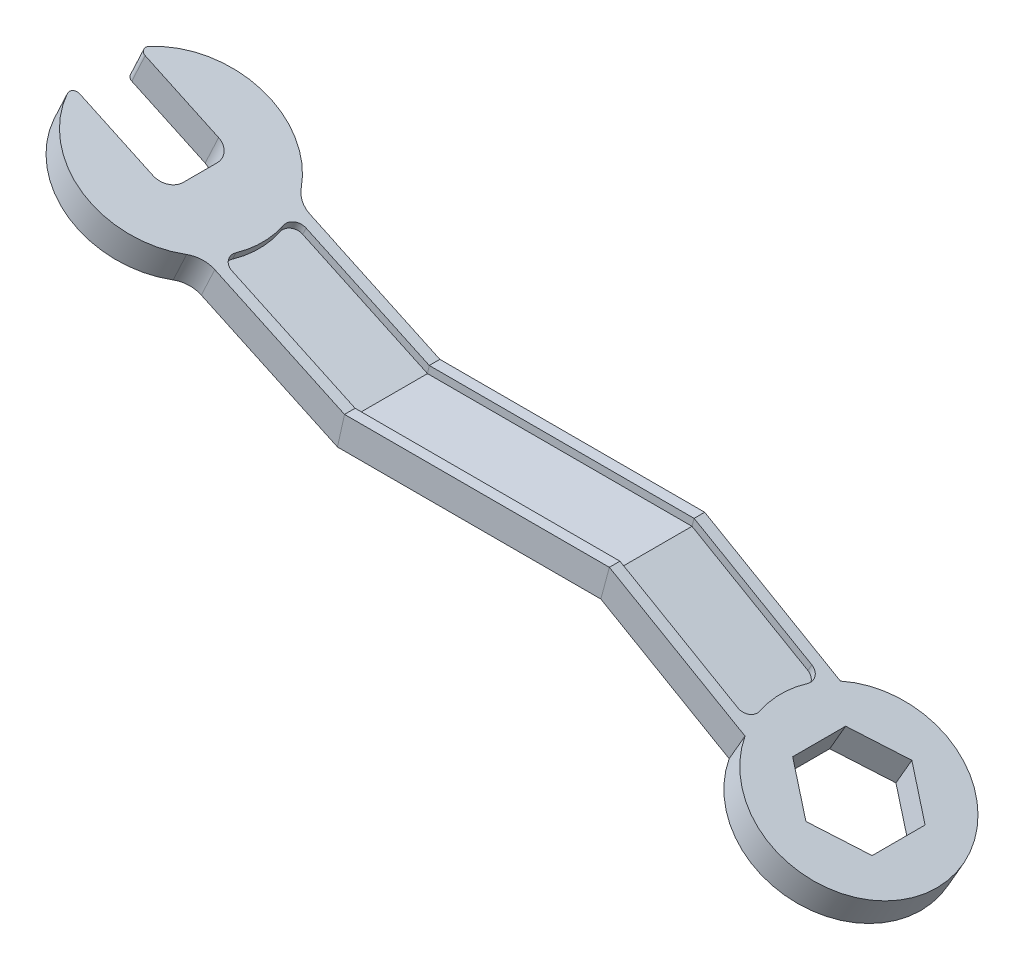
from build123d import *

# Parameters (mm, degrees)
EXTRUDE_START       = 1.5
EXTRUDE_1_DEPTH     = 6
FILLET_1_R          = 1
FILLET_2_R          = 5
FILLET_3_R          = 3
CUT_EXTRUDE_1_DEPTH = 1.5
FILLET_4_R          = 2
CUT_EXTRUDE_START   = -4.5
CUT_EXTRUDE_2_DEPTH = 1.5
FILLET_5_R          = 2
EXTRUDE_2_DEPTH     = 6
CUT_EXTRUDE_3_DEPTH = 1.5
FILLET_6_R          = 2
CUT_EXTRUDE_4_DEPTH = 1.5
FILLET_7_R          = 2


with BuildPart() as part:
    # 扫描2: sweep along a path in 草图1
    with BuildLine(Plane.XY) as sweep_2_path:
        Line((-19.938771315, 9.297601758), (0, 0))
        Line((0, 0), (50, 0))
        Line((50, 0), (69.052558883, -11))
    # 草图2 → 扫描2 (sweep)
    with BuildSketch(Plane(origin=(0, 0, 0), x_dir=(0, 0, -1), z_dir=(1, 0, 0))):
        Polygon((0, 0), (2, 0), (2, -1.5), (16, -1.5), (16, 0), (18, 0), (18, -6), (16, -6), (16, -4.5), (2, -4.5), (2, -6), (0, -6), align=None)
    sweep(path=sweep_2_path.line, transition=Transition.RIGHT)

    # 草图3 → 凸台-拉伸1 (add)
    with BuildSketch(Plane(origin=(-0.633927393, -1.359461681, 0), x_dir=(0.9063077870366528, -0.42261826174069356, 0), z_dir=(0.42261826174069356, 0.9063077870366528, 0)).offset(EXTRUDE_START)):
        with BuildLine():
            Line((-22, 9), (-22, 18.019216451))
            Line((-22, 18.019216451), (-29.589804491, 18.019216451))
            ThreePointArc((-29.589804491, 18.019216451), (-45.578071203, 25.926597156), (-59.82908715, 15.2))
            Line((-59.82908715, 15.2), (-40, 15.2))
            Line((-40, 15.2), (-40, 9))
            Line((-40, 9), (-40, 2.8))
            Line((-40, 2.8), (-59.82908715, 2.8))
            ThreePointArc((-59.82908715, 2.8), (-45.56678948, -7.927645162), (-29.577794898, 0))
            Line((-29.577794898, 0), (-22, 0))
            Line((-22, 0), (-22, 9))
        make_face()
    extrude(amount=-EXTRUDE_1_DEPTH)

    # 圆角1
    fillet_1_edges = [part.edges().sort_by_distance(p)[0] for p in [
        (-55.49142236, 22.565941452, -2.8),
        (-55.49142236, 22.565941452, -15.2),
    ]]
    fillet(fillet_1_edges, radius=FILLET_1_R)

    # 圆角2
    fillet_2_edges = [part.edges().sort_by_distance(p)[0] for p in [
        (-28.074440625, 9.781192905, 0),
        (-28.085325012, 9.786268378, -18.019216451),
    ]]
    fillet(fillet_2_edges, radius=FILLET_2_R)

    # 圆角3
    fillet_3_edges = [part.edges().sort_by_distance(p)[0] for p in [
        (-37.520166267, 14.185807109, -2.8),
        (-37.520166267, 14.185807109, -15.2),
    ]]
    fillet(fillet_3_edges, radius=FILLET_3_R)

    # 草图4 → 切除-拉伸1 (cut)
    with BuildSketch(Plane(origin=(0, 0, 0), x_dir=(0.9063077870366528, -0.42261826174069356, 0), z_dir=(0.42261826174069356, 0.9063077870366528, 0))):
        with BuildLine():
            Line((-22, 16), (-28.508066615, 16))
            ThreePointArc((-28.508066615, 16), (-27, 9), (-28.508066615, 2))
            Line((-28.508066615, 2), (-22, 2))
            Line((-22, 2), (-22, 16))
        make_face()
    extrude(amount=-CUT_EXTRUDE_1_DEPTH, mode=Mode.SUBTRACT)

    # 圆角4
    fillet_4_edges = [part.edges().sort_by_distance(p)[0] for p in [
        (-26.154046463, 11.368298718, -2),
        (-26.154046463, 11.368298718, -16),
    ]]
    fillet(fillet_4_edges, radius=FILLET_4_R)

    # 草图4<2> → 切除-拉伸2 (cut)
    with BuildSketch(Plane(origin=(0, 0, 0), x_dir=(0.9063077870366528, -0.42261826174069356, 0), z_dir=(0.42261826174069356, 0.9063077870366528, 0)).offset(CUT_EXTRUDE_START)):
        with BuildLine():
            Line((-22, 16), (-28.508066615, 16))
            ThreePointArc((-28.508066615, 16), (-27, 9), (-28.508066615, 2))
            Line((-28.508066615, 2), (-22, 2))
            Line((-22, 2), (-22, 16))
        make_face()
    extrude(amount=-CUT_EXTRUDE_2_DEPTH, mode=Mode.SUBTRACT)

    # 圆角5
    fillet_5_edges = [part.edges().sort_by_distance(p)[0] for p in [
        (-28.055828641, 7.289913677, -16),
        (-28.055828641, 7.289913677, -2),
    ]]
    fillet(fillet_5_edges, radius=FILLET_5_R)

    # 草图7 → 凸台-拉伸2 (add)
    with BuildSketch(Plane(origin=(12.5, 21.650635095, 0), x_dir=(0.866025403784438, -0.5000000000000012, 0), z_dir=(0.5000000000000011, 0.8660254037844379, 0))):
        with BuildLine():
            Line((72.879065087, 18), (65.301270189, 18))
            Line((65.301270189, 18), (65.301270189, 16))
            Line((65.301270189, 16), (65.301270189, 0))
            Line((65.301270189, 0), (72.879065087, 0))
            ThreePointArc((72.879065087, 0), (104.301270189, 9), (72.879065087, 18))
        make_face()
        Polygon((78.641016151, 14), (87.301270189, 19), (95.961524227, 14), (95.961524227, 4), (87.301270189, -1), (78.641016151, 4), align=None, mode=Mode.SUBTRACT)
    extrude(amount=-EXTRUDE_2_DEPTH)

    # 草图8 → 切除-拉伸3 (cut)
    with BuildSketch(Plane(origin=(12.5, 21.650635095, 0), x_dir=(0.866025403784438, -0.5000000000000012, 0), z_dir=(0.5000000000000011, 0.8660254037844379, 0))):
        with BuildLine():
            Line((65.301270189, 16), (65.301270189, 2))
            Line((65.301270189, 2), (71.809336804, 2))
            ThreePointArc((71.809336804, 2), (70.301270189, 9), (71.809336804, 16))
            Line((71.809336804, 16), (65.301270189, 16))
        make_face()
    extrude(amount=-CUT_EXTRUDE_3_DEPTH, mode=Mode.SUBTRACT)

    # 圆角6
    fillet_6_edges = [part.edges().sort_by_distance(p)[0] for p in [
        (74.313709902, -14.90355236, -2),
        (74.313709902, -14.90355236, -16),
    ]]
    fillet(fillet_6_edges, radius=FILLET_6_R)

    # 草图8<2> → 切除-拉伸4 (cut)
    with BuildSketch(Plane(origin=(12.5, 21.650635095, 0), x_dir=(0.866025403784438, -0.5000000000000012, 0), z_dir=(0.5000000000000011, 0.8660254037844379, 0)).offset(CUT_EXTRUDE_START)):
        with BuildLine():
            Line((65.301270189, 16), (65.301270189, 2))
            Line((65.301270189, 2), (71.809336804, 2))
            ThreePointArc((71.809336804, 2), (70.301270189, 9), (71.809336804, 16))
            Line((71.809336804, 16), (65.301270189, 16))
        make_face()
    extrude(amount=-CUT_EXTRUDE_4_DEPTH, mode=Mode.SUBTRACT)

    # 圆角7
    fillet_7_edges = [part.edges().sort_by_distance(p)[0] for p in [
        (72.063709902, -18.800666677, -16),
        (72.063709902, -18.800666677, -2),
    ]]
    fillet(fillet_7_edges, radius=FILLET_7_R)


solid = part.part
